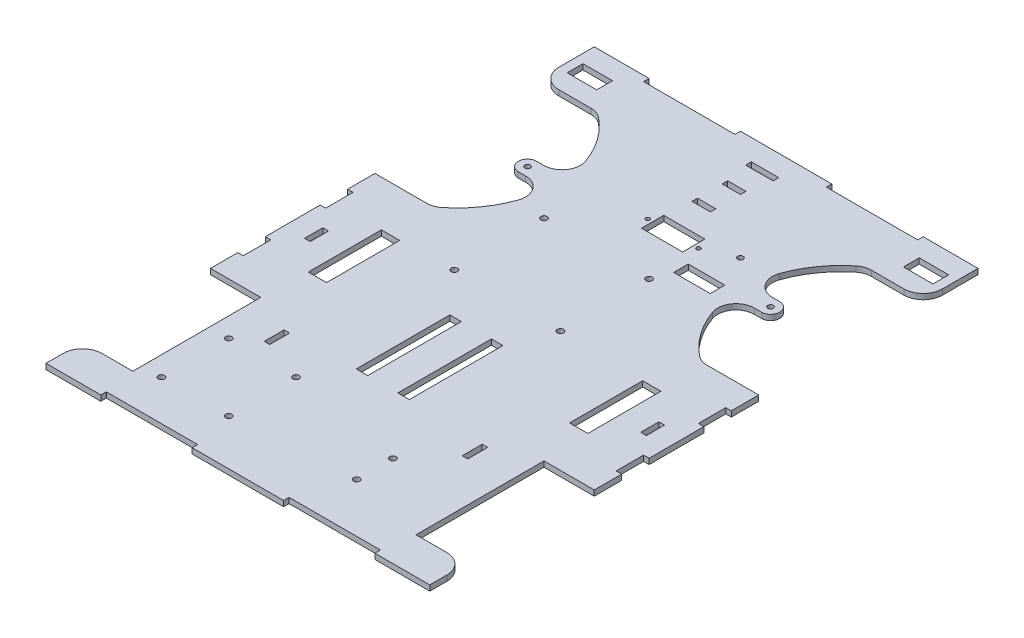
from build123d import *

# Parameters (mm, degrees)
CHASIS_BASE_DEPTH                     = 3
ARM_HOLES_DEPTH                       = 279.202975413
ARM_HOLES_DEPTH_BACK                  = 279.202975413
SKETCH3_R                             = 1.5
SERVO_SLOT_DEPTH                      = 279.202975413
SERVO_SLOT_DEPTH_BACK                 = 279.202975413
SERVO_SCREW_HOLES_DEPTH               = 279.202975413
SERVO_SCREW_HOLES_DEPTH_BACK          = 279.202975413
SKETCH6_R                             = 1.1
FRONT_AND_BACK_SLOTS_DEPTH            = 279.202975413
FRONT_AND_BACK_SLOTS_DEPTH_BACK       = 279.202975413
SKETCH7_W                             = 50
SKETCH7_H                             = 3
CHASIS_SUPPORT_SLOT_DEPTH             = 279.202975413
CHASIS_SUPPORT_SLOT_DEPTH_BACK        = 279.202975413
SKETCH8_W                             = 10
SKETCH8_H                             = 3
IR_SLOTS_DEPTH                        = 279.202975413
IR_SLOTS_DEPTH_BACK                   = 279.202975413
SKETCH9_W                             = 16.15
SKETCH9_H                             = 8.63
FRONT_ULTRASONIC_SLOT_DEPTH           = 10
CAMERA_HOLDER_SLOT_DEPTH              = 279.202975413
CAMERA_HOLDER_SLOT_DEPTH_BACK         = 279.202975413
SKETCH11_W                            = 10
SKETCH11_H                            = 3
BACK_WHEELS_DEPTH                     = 279.202975413
BACK_WHEELS_DEPTH_BACK                = 279.202975413
MOTOR_HOLDERS_SLOTS_DEPTH             = 279.202975413
MOTOR_HOLDERS_SLOTS_DEPTH_BACK        = 279.202975413
SKETCH16_W                            = 3
SKETCH16_H                            = 10.9
SIDE_SLOTS_DEPTH                      = 279.202975413
SIDE_SLOTS_DEPTH_BACK                 = 279.202975413
SKETCH17_W                            = 3
SKETCH17_H                            = 15
SIDE_ULTRASONIC_PINS_SLOTS_DEPTH      = 279.202975413
SIDE_ULTRASONIC_PINS_SLOTS_DEPTH_BACK = 279.202975413
SKETCH19_W                            = 3.1
SKETCH19_H                            = 10
SKETCH20_R                            = 1.5
LDR_SCREW_DEPTH                       = 10
FILLET_2_DEPTH                        = 10
SKETCH22_R                            = 1.7
RPI_DEPTH                             = 10
SKETCH23_R                            = 1.7
L289N_DEPTH                           = 10
SKETCH24_R                            = 1.7
BATTERIES_DEPTH                       = 10
SKETCH27_W                            = 20
SKETCH27_H                            = 8
SKETCH27_W_2                          = 10
SKETCH27_H_2                          = 40
WIRIG_DEPTH                           = 10
SKETCH28_W                            = 6.291094042
SKETCH28_H                            = 51.2
ESP32_DEPTH                           = 10


with BuildPart() as part:
    # Sketch1 → Chasis Base (new body)
    with BuildSketch(Plane(origin=(0, 0, 0), x_dir=(1, 0, 0), z_dir=(0, 1, 0))):
        with BuildLine():
            Line((16.110739543, -0.742439233), (12.18607051, -0.742439233))
            ThreePointArc((12.18607051, -0.742439233), (4.020770322, 3.484530987), (2.758366281, 12.591986198))
            ThreePointArc((2.758366281, 12.591986198), (9.705266825, 26.009512038), (20.041074685, 37.030424102))
            ThreePointArc((20.041074685, 37.030424102), (22.993134963, 38.68073674), (26.326468296, 39.252646324))
            Line((26.326468296, 39.252646324), (54.610739543, 39.252646324))
            Line((54.610739543, 39.252646324), (54.610739543, 69.257560767))
            Line((54.610739543, 69.257560767), (-155.389260457, 69.257560767))
            Line((-155.389260457, 69.257560767), (-155.389260457, 39.252646324))
            Line((-155.389260457, 39.252646324), (-127.104989209, 39.252646324))
            ThreePointArc((-127.104989209, 39.252646324), (-123.771655876, 38.68073674), (-120.819595599, 37.030424102))
            ThreePointArc((-120.819595599, 37.030424102), (-110.483787739, 26.009512038), (-103.536887194, 12.591986198))
            ThreePointArc((-103.536887194, 12.591986198), (-104.799291236, 3.484530987), (-112.964591423, -0.742439233))
            Line((-112.964591423, -0.742439233), (-116.889260457, -0.742439233))
            ThreePointArc((-116.889260457, -0.742439233), (-121.892639989, -5.6234108), (-117.137070186, -10.746129417))
            Line((-117.137070186, -10.746129417), (-112.964129997, -10.745292706))
            ThreePointArc((-112.964129997, -10.745292706), (-104.797878225, -14.970772949), (-103.533872564, -24.0781678))
            ThreePointArc((-103.533872564, -24.0781678), (-110.481177178, -37.500527632), (-120.819595599, -48.525131454))
            ThreePointArc((-120.819595599, -48.525131454), (-123.771655876, -50.175444092), (-127.104989209, -50.747353676))
            Line((-127.104989209, -50.747353676), (-155.389260457, -50.747353676))
            Line((-155.389260457, -50.747353676), (-155.389260457, -80.742439233))
            Line((-155.389260457, -80.742439233), (-155.389260457, -230.742439233))
            Line((-155.389260457, -230.742439233), (54.610739543, -230.742439233))
            Line((54.610739543, -230.742439233), (54.610739543, -80.742439233))
            Line((54.610739543, -80.742439233), (54.610739543, -50.747353676))
            Line((54.610739543, -50.747353676), (26.326468296, -50.747353676))
            ThreePointArc((26.326468296, -50.747353676), (22.993134963, -50.175444092), (20.041074685, -48.525131454))
            ThreePointArc((20.041074685, -48.525131454), (9.702656265, -37.500527632), (2.75535165, -24.0781678))
            ThreePointArc((2.75535165, -24.0781678), (4.019357312, -14.970772949), (12.185609084, -10.745292706))
            Line((12.185609084, -10.745292706), (16.358549273, -10.746129417))
            ThreePointArc((16.358549273, -10.746129417), (21.114119075, -5.6234108), (16.110739543, -0.742439233))
        make_face()
    extrude(amount=CHASIS_BASE_DEPTH)

    # Sketch3 → Arm Holes (cut, two sides: drawn at the far end of the back side and taken through both)
    with BuildSketch(Plane(origin=(0, 3, 0), x_dir=(1, 0, 0), z_dir=(0, 1, 0)).offset(-ARM_HOLES_DEPTH_BACK)):
        with Locations((-116.889260457, -5.747353676)):
            Circle(SKETCH3_R)
        with Locations((16.110739543, -5.747353676)):
            Circle(SKETCH3_R)
    extrude(amount=ARM_HOLES_DEPTH + ARM_HOLES_DEPTH_BACK, mode=Mode.SUBTRACT)

    # Sketch5 → Servo Slot (cut, two sides: drawn at the far end of the back side and taken through both)
    with BuildSketch(Plane.XZ.offset(-SERVO_SLOT_DEPTH_BACK)):
        Polygon((-56.489260457, -0.332740172), (-56.489260457, 3.797353676), (-53.795285424, 3.797353676), (-33.989260457, 3.797353676), (-33.989260457, -1.763083762), (-33.989260457, -8.402646324), (-37.772374386, -8.402646324), (-56.489260457, -8.402646324), align=None)
    extrude(amount=SERVO_SLOT_DEPTH + SERVO_SLOT_DEPTH_BACK, mode=Mode.SUBTRACT)

    # Sketch6 → Servo Screw Holes (cut, two sides: drawn at the far end of the back side and taken through both)
    with BuildSketch(Plane(origin=(0, 3, 0), x_dir=(1, 0, 0), z_dir=(0, 1, 0)).offset(-SERVO_SCREW_HOLES_DEPTH_BACK)):
        with Locations((-59.139260457, 2.302646324)):
            Circle(SKETCH6_R)
        with Locations((-31.339260457, 2.302646324)):
            Circle(SKETCH6_R)
    extrude(amount=SERVO_SCREW_HOLES_DEPTH + SERVO_SCREW_HOLES_DEPTH_BACK, mode=Mode.SUBTRACT)

    # Sketch7 → Front and Back Slots (cut, two sides: drawn at the far end of the back side and taken through both)
    with BuildSketch(Plane(origin=(0, 3, 0), x_dir=(1, 0, 0), z_dir=(0, 1, 0)).offset(-FRONT_AND_BACK_SLOTS_DEPTH_BACK)):
        with Locations((-100.389260457, 67.757560767)):
            Rectangle(SKETCH7_W, SKETCH7_H)
        with Locations((-0.389260457, 67.757560767)):
            Rectangle(SKETCH7_W, SKETCH7_H)
        with Locations((-0.389260457, -229.242439233)):
            Rectangle(SKETCH7_W, SKETCH7_H)
        with Locations((-100.389260457, -229.242439233)):
            Rectangle(SKETCH7_W, SKETCH7_H)
    extrude(amount=FRONT_AND_BACK_SLOTS_DEPTH + FRONT_AND_BACK_SLOTS_DEPTH_BACK, mode=Mode.SUBTRACT)

    # Sketch8 → Chasis Support Slot (cut, two sides: drawn at the far end of the back side and taken through both)
    with BuildSketch(Plane.XZ.offset(-CHASIS_SUPPORT_SLOT_DEPTH_BACK)):
        with Locations((-50.389260457, -40.757560767)):
            Rectangle(SKETCH8_W, SKETCH8_H)
    extrude(amount=CHASIS_SUPPORT_SLOT_DEPTH + CHASIS_SUPPORT_SLOT_DEPTH_BACK, mode=Mode.SUBTRACT)

    # Sketch9 → IR Slots (cut, two sides: drawn at the far end of the back side and taken through both)
    with BuildSketch(Plane(origin=(0, 3, 0), x_dir=(1, 0, 0), z_dir=(0, 1, 0)).offset(-IR_SLOTS_DEPTH_BACK)):
        with Locations((-142.389260457, 53.842560767)):
            Rectangle(SKETCH9_W, SKETCH9_H)
        with Locations((41.610739543, 53.842560767)):
            Rectangle(SKETCH9_W, SKETCH9_H)
    extrude(amount=IR_SLOTS_DEPTH + IR_SLOTS_DEPTH_BACK, mode=Mode.SUBTRACT)

    # Sketch10 → Front Ultrasonic Slot (cut)
    with BuildSketch(Plane(origin=(0, 0, 0), x_dir=(-1, 0, 0), z_dir=(0, -1, 0))):
        Polygon((45.389260457, 54.642453006), (42.889260457, 54.642453006), (42.889260457, 57.717560767), (45.389260457, 57.717560767), (55.389260457, 57.717560767), (57.889260457, 57.717560767), (57.889260457, 54.617560767), (55.389260457, 54.617560767), align=None)
    extrude(amount=-FRONT_ULTRASONIC_SLOT_DEPTH, mode=Mode.SUBTRACT)

    # Sketch11 → Camera Holder Slot (cut, two sides: drawn at the far end of the back side and taken through both)
    with BuildSketch(Plane(origin=(0, 3, 0), x_dir=(1, 0, 0), z_dir=(0, 1, 0)).offset(-CAMERA_HOLDER_SLOT_DEPTH_BACK)):
        with Locations((-50.389260457, 24.257560767)):
            Rectangle(SKETCH11_W, SKETCH11_H)
    extrude(amount=CAMERA_HOLDER_SLOT_DEPTH + CAMERA_HOLDER_SLOT_DEPTH_BACK, mode=Mode.SUBTRACT)

    # Sketch15 → Back Wheels (cut, two sides: drawn at the far end of the back side and taken through both)
    with BuildSketch(Plane(origin=(0, 3, 0), x_dir=(1, 0, 0), z_dir=(0, 1, 0)).offset(-BACK_WHEELS_DEPTH_BACK)):
        Polygon((-155.389260457, -175.747353676), (-155.389260457, -140.747353676), (-127.889260457, -140.747353676), (-127.889260457, -210.747353676), (-155.389260457, -210.747353676), align=None)
        Polygon((54.610739543, -140.747353676), (27.110739543, -140.747353676), (27.110739543, -210.747353676), (54.610739543, -210.747353676), (54.610739543, -175.747353676), align=None)
    extrude(amount=BACK_WHEELS_DEPTH + BACK_WHEELS_DEPTH_BACK, mode=Mode.SUBTRACT)

    # Sketch16 → Motor Holders Slots (cut, two sides: drawn at the far end of the back side and taken through both)
    with BuildSketch(Plane(origin=(0, 3, 0), x_dir=(1, 0, 0), z_dir=(0, 1, 0)).offset(-MOTOR_HOLDERS_SLOTS_DEPTH_BACK)):
        with Locations((-104.589260457, -155.177353676)):
            Rectangle(SKETCH16_W, SKETCH16_H)
        with Locations((3.810739543, -155.177353676)):
            Rectangle(SKETCH16_W, SKETCH16_H)
    extrude(amount=MOTOR_HOLDERS_SLOTS_DEPTH + MOTOR_HOLDERS_SLOTS_DEPTH_BACK, mode=Mode.SUBTRACT)

    # Sketch17 → Side Slots (cut, two sides: drawn at the far end of the back side and taken through both)
    with BuildSketch(Plane(origin=(0, 0, 0), x_dir=(1, 0, 0), z_dir=(0, 1, 0)).offset(-SIDE_SLOTS_DEPTH_BACK)):
        with Locations((-153.889260457, -73.247353676)):
            Rectangle(SKETCH17_W, SKETCH17_H)
        with Locations((-153.889260457, -118.247353676)):
            Rectangle(SKETCH17_W, SKETCH17_H)
        with Locations((53.110739543, -118.247353676)):
            Rectangle(SKETCH17_W, SKETCH17_H)
        with Locations((53.110739543, -73.247353676)):
            Rectangle(SKETCH17_W, SKETCH17_H)
    extrude(amount=SIDE_SLOTS_DEPTH + SIDE_SLOTS_DEPTH_BACK, mode=Mode.SUBTRACT)

    # Sketch19 → Side Ultrasonic Pins Slots (cut, two sides: drawn at the far end of the back side and taken through both)
    with BuildSketch(Plane.XZ.offset(-SIDE_ULTRASONIC_PINS_SLOTS_DEPTH_BACK)):
        with Locations((-142.349260457, 95.747353676)):
            Rectangle(SKETCH19_W, SKETCH19_H)
        with Locations((41.570739543, 95.747353676)):
            Rectangle(SKETCH19_W, SKETCH19_H)
    extrude(amount=SIDE_ULTRASONIC_PINS_SLOTS_DEPTH + SIDE_ULTRASONIC_PINS_SLOTS_DEPTH_BACK, mode=Mode.SUBTRACT)

    # Sketch20 → LDR Screw (cut)
    with BuildSketch(Plane(origin=(0, 3, 0), x_dir=(1, 0, 0), z_dir=(0, 1, 0))):
        with Locations((-15.389260457, 9.257560767)):
            Circle(SKETCH20_R)
    extrude(amount=-LDR_SCREW_DEPTH, mode=Mode.SUBTRACT)

    # Sketch21 → Fillet 2 (cut)
    with BuildSketch(Plane(origin=(0, 3, 0), x_dir=(1, 0, 0), z_dir=(0, 1, 0))):
        with BuildLine():
            Line((-155.389260457, 39.252646324), (-155.389260457, 49.859248042))
            ThreePointArc((-155.389260457, 49.859248042), (-152.282658739, 42.359248042), (-144.782658739, 39.252646324))
            Line((-144.782658739, 39.252646324), (-155.389260457, 39.252646324))
        make_face()
        with BuildLine():
            Line((44.004137826, 39.252646324), (54.610739543, 39.252646324))
            Line((54.610739543, 39.252646324), (54.610739543, 49.859248042))
            ThreePointArc((54.610739543, 49.859248042), (51.504137826, 42.359248042), (44.004137826, 39.252646324))
        make_face()
        with BuildLine():
            Line((-155.389260457, -221.353955394), (-155.389260457, -210.747353676))
            Line((-155.389260457, -210.747353676), (-144.782658739, -210.747353676))
            ThreePointArc((-144.782658739, -210.747353676), (-152.282658739, -213.853955394), (-155.389260457, -221.353955394))
        make_face()
        with BuildLine():
            Line((54.610739543, -210.747353676), (54.610739543, -221.353955394))
            ThreePointArc((54.610739543, -221.353955394), (51.504137826, -213.853955394), (44.004137826, -210.747353676))
            Line((44.004137826, -210.747353676), (54.610739543, -210.747353676))
        make_face()
    extrude(amount=-FILLET_2_DEPTH, mode=Mode.SUBTRACT)

    # Sketch22 → RPi (cut)
    with BuildSketch(Plane(origin=(0, 3, 0), x_dir=(1, 0, 0), z_dir=(0, 1, 0))):
        with Locations((-30.389260457, -25.742439233)):
            Circle(SKETCH22_R)
        with Locations((-87.889260457, -25.742439233)):
            Circle(SKETCH22_R)
        with Locations((-87.889260457, -74.742439233)):
            Circle(SKETCH22_R)
        with Locations((-29.889260457, -74.742439233)):
            Circle(SKETCH22_R)
    extrude(amount=-RPI_DEPTH, mode=Mode.SUBTRACT)

    # Sketch23 → L289N (cut)
    with BuildSketch(Plane(origin=(0, 3, 0), x_dir=(1, 0, 0), z_dir=(0, 1, 0))):
        with Locations((-80.389260457, -205.742439233)):
            Circle(SKETCH23_R)
        with Locations((-117.214260457, -205.742439233)):
            Circle(SKETCH23_R)
        with Locations((-117.214260457, -168.917439233)):
            Circle(SKETCH23_R)
        with Locations((-80.389260457, -168.917439233)):
            Circle(SKETCH23_R)
    extrude(amount=-L289N_DEPTH, mode=Mode.SUBTRACT)

    # Sketch24 → Batteries (cut)
    with BuildSketch(Plane(origin=(0, 3, 0), x_dir=(1, 0, 0), z_dir=(0, 1, 0))):
        with Locations((-15.389260457, -200.742439233)):
            Circle(SKETCH24_R)
        with Locations((-15.389260457, -180.892439233)):
            Circle(SKETCH24_R)
    extrude(amount=-BATTERIES_DEPTH, mode=Mode.SUBTRACT)

    # Sketch27 → Wirig (cut)
    with BuildSketch(Plane(origin=(0, 3, 0), x_dir=(1, 0, 0), z_dir=(0, 1, 0))):
        with Locations((-16.700106193, -11.954360227)):
            Rectangle(SKETCH27_W, SKETCH27_H)
        with Locations((-121.885790104, -95.747353676)):
            Rectangle(SKETCH27_W_2, SKETCH27_H_2)
        with Locations((21.107269191, -95.747353676)):
            Rectangle(SKETCH27_W_2, SKETCH27_H_2)
    extrude(amount=-WIRIG_DEPTH, mode=Mode.SUBTRACT)

    # Sketch28 → ESP32 (cut)
    with BuildSketch(Plane(origin=(0, 3, 0), x_dir=(1, 0, 0), z_dir=(0, 1, 0))):
        with Locations((-64.69136994, -122.915043714)):
            Rectangle(SKETCH28_W, SKETCH28_H)
        with Locations((-41.933922659, -122.915043714)):
            Rectangle(SKETCH28_W, SKETCH28_H)
    extrude(amount=-ESP32_DEPTH, mode=Mode.SUBTRACT)


solid = part.part
